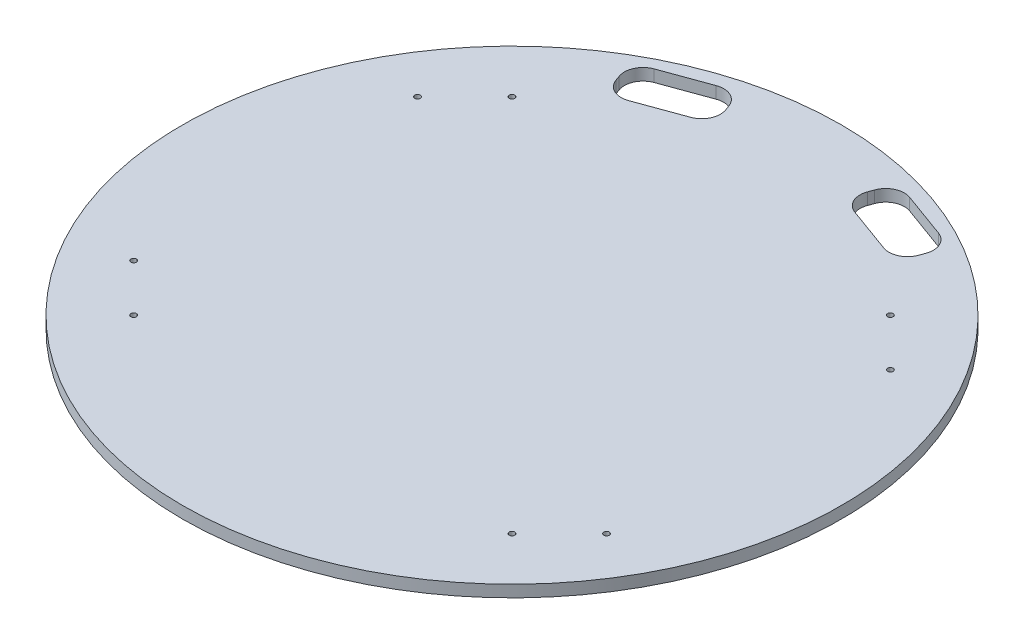
from build123d import *

# Parameters (mm, degrees)
SKETCH1_R           = 177
SKETCH1_R_2         = 1.5
BOSS_EXTRUDE1_DEPTH = 6.35


with BuildPart() as part:
    # Sketch1 → Boss-Extrude1 (new body)
    with BuildSketch(Plane(origin=(0, 0, 0), x_dir=(1, 0, 0), z_dir=(0, 1, 0))):
        with Locations(Location((0, 0, 0), (0, 0, 270))):
            Circle(SKETCH1_R)
        with Locations(Location((-101.6, -101.6, 0), (0, 0, 270))):
            Circle(SKETCH1_R_2, mode=Mode.SUBTRACT)
        with Locations(Location((-101.6, 101.6, 0), (0, 0, 270))):
            Circle(SKETCH1_R_2, mode=Mode.SUBTRACT)
        with Locations(Location((101.6, 101.6, 0), (0, 0, 270))):
            Circle(SKETCH1_R_2, mode=Mode.SUBTRACT)
        with Locations(Location((101.6, -101.6, 0), (0, 0, 270))):
            Circle(SKETCH1_R_2, mode=Mode.SUBTRACT)
        with Locations(Location((-127, 76.2, 0), (0, 0, 270))):
            Circle(SKETCH1_R_2, mode=Mode.SUBTRACT)
        with Locations(Location((127, 76.2, 0), (0, 0, 270))):
            Circle(SKETCH1_R_2, mode=Mode.SUBTRACT)
        with Locations(Location((127, -76.2, 0), (0, 0, 270))):
            Circle(SKETCH1_R_2, mode=Mode.SUBTRACT)
        with Locations(Location((-127, -76.2, 0), (0, 0, 270))):
            Circle(SKETCH1_R_2, mode=Mode.SUBTRACT)
        with BuildLine():
            Line((-76.375196212, 152.726666572), (-51.943188071, 161.619190299))
            ThreePointArc((-51.943188071, 161.619190299), (-44.29680402, 161.285341961), (-39.12606043, 155.642465524))
            Line((-39.12606043, 155.642465524), (-38.1, 152.823387662))
            ThreePointArc((-38.1, 152.823387662), (-38.433848337, 145.177003611), (-44.076724775, 140.006260021))
            Line((-44.076724775, 140.006260021), (-68.508732915, 131.113736294))
            ThreePointArc((-68.508732915, 131.113736294), (-76.155116966, 131.447584632), (-81.325860556, 137.090461069))
            Line((-81.325860556, 137.090461069), (-82.351920986, 139.909538931))
            ThreePointArc((-82.351920986, 139.909538931), (-82.018072649, 147.555922982), (-76.375196212, 152.726666572))
        make_face(mode=Mode.SUBTRACT)
        with BuildLine():
            Line((51.943188071, 161.619190299), (76.375196212, 152.726666572))
            ThreePointArc((76.375196212, 152.726666572), (82.018072649, 147.555922982), (82.351920986, 139.909538931))
            Line((82.351920986, 139.909538931), (81.325860556, 137.090461069))
            ThreePointArc((81.325860556, 137.090461069), (76.155116966, 131.447584632), (68.508732915, 131.113736294))
            Line((68.508732915, 131.113736294), (44.076724775, 140.006260021))
            ThreePointArc((44.076724775, 140.006260021), (38.433848337, 145.177003611), (38.1, 152.823387662))
            Line((38.1, 152.823387662), (39.12606043, 155.642465524))
            ThreePointArc((39.12606043, 155.642465524), (44.29680402, 161.285341961), (51.943188071, 161.619190299))
        make_face(mode=Mode.SUBTRACT)
    extrude(amount=BOSS_EXTRUDE1_DEPTH)


solid = part.part
